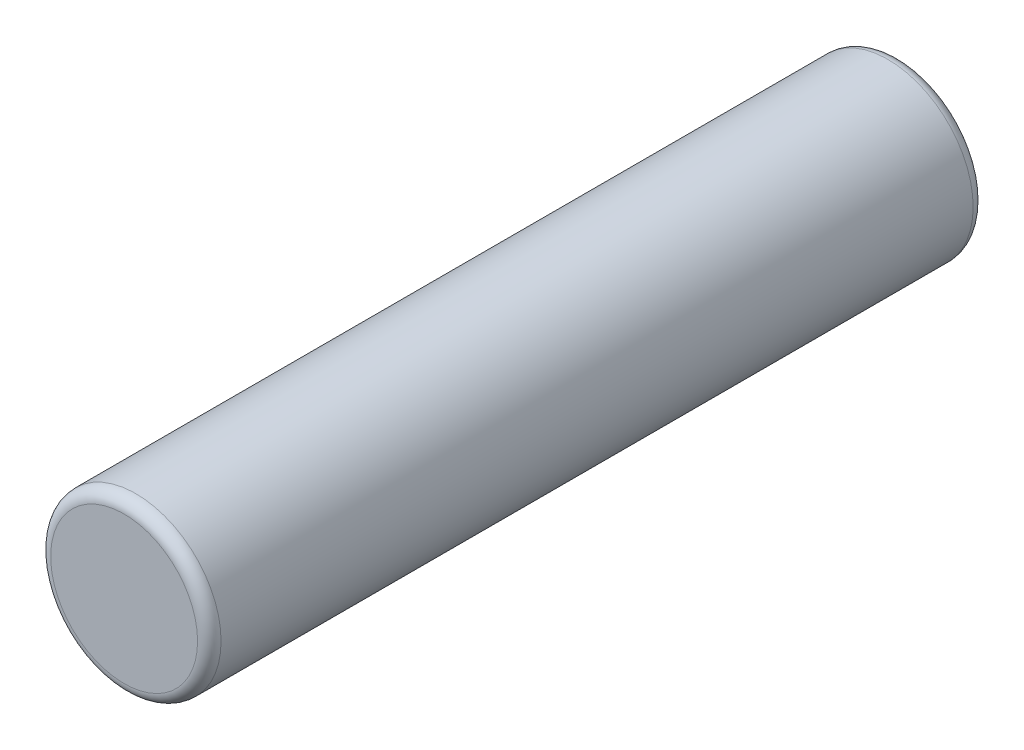
from build123d import *

# Parameters (mm, degrees)
SKETCH2_R           = 7.25
BOSS_EXTRUDE1_DEPTH = 33
FILLET1_R           = 1


with BuildPart() as part:
    # Sketch2 → Boss-Extrude1 (new, symmetric)
    with BuildSketch(Plane.XY):
        Circle(SKETCH2_R)
    extrude(amount=BOSS_EXTRUDE1_DEPTH, both=True)

    # Fillet1
    fillet1_edges = [part.edges().sort_by_distance(p)[0] for p in [
        (-7.25, 0, -33),
        (-7.25, 0, 33),
    ]]
    fillet(fillet1_edges, radius=FILLET1_R)


solid = part.part
